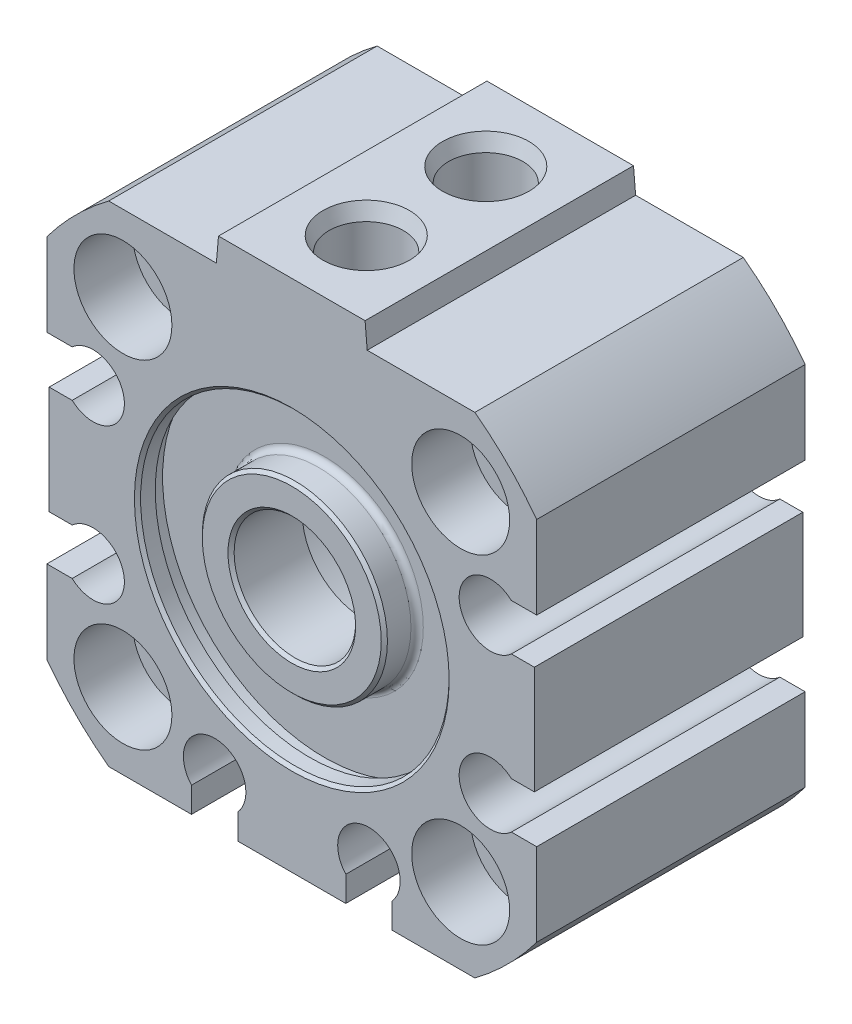
from build123d import *

# Parameters (mm, degrees)
EXTRUDE1_DEPTH                               = 8.6995
EXTRUDE1_DEPTH_BACK                          = 8.6995
SKETCH1_W                                    = 31.75
SKETCH1_H                                    = 31.75
F_056_250_NOSE_CHAMFER_R                     = 0.4
SKETCH13_R                                   = 22.450640303
SKETCH13_R_2                                 = 19.82
F_075_250_TUBE_EDGE_ROUNDOVER_DEPTH          = 29.403458434
F_075_250_PORT_BOSS_DEPTH                    = 17.399
F_075_PORT_10_32_AT_2_COUNT                  = 2
F_075_PORT_10_32_AT_2_PITCH                  = 7.747
F_075_250_SWITCH_GROOVE_DEPTH                = 30.321784581
F_075_106_SWITCH_GROOVE_CIRC_PATTERN_COUNT   = 3
F_075_106_SWITCH_GROOVE_CIRC_PATTERN_ANGLE   = 180
SKETCH19_W                                   = 0.15
SKETCH19_H                                   = 7
F_075_250_THIN_SIDE_CUTS_DEPTH               = 30.321784581
SKETCH20_R                                   = 1.95
F_075_250_MOUNT_THRU_HOLE_DEPTH              = 30.321784581
F_075_250_MOUNT_THRU_HOLE_CIRC_PATTERN_COUNT = 4
SKETCH21_R                                   = 3.175
F_075_250_B_MOUNT_CBORE_ROD_END_DEPTH        = 3.81
F_056_250_START                              = -4.0875
SKETCH22_R                                   = 9.525
F_056_250_STROKE_CHAMBER_DEPTH               = 8.175
SKETCH23_R                                   = 3.937
F_056_250_ROD_THRU_BORE_DEPTH                = 26.153988754
F_056_250_COLLAR_CHAMFER_SIZE                = 0.2


with BuildPart() as part:
    # Sketch1 → Extrude1 (new, two sides: drawn at the far end of the back side and taken through both)
    with BuildSketch(Plane.XY.offset(-EXTRUDE1_DEPTH_BACK)):
        Rectangle(SKETCH1_W, SKETCH1_H)
    extrude(amount=EXTRUDE1_DEPTH + EXTRUDE1_DEPTH_BACK)

    # Sketch33 → 056-250 Front Recess (revolve, cut)
    with BuildSketch(Plane(origin=(0, 0, 0), x_dir=(0, 0, -1), z_dir=(1, 0, 0)), mode=Mode.PRIVATE) as f_056_250_front_recess_sk:
        Polygon((-8.6995, 10), (-7.5495, 10), (-7.5495, 10.5), (-6.5745, 10.5), (-6.5745, 6), (-8.6995, 6), align=None)
    revolve(f_056_250_front_recess_sk.sketch.rotate(Axis((0, 0, 61.220394237), (0, 0, -1)), 90), axis=Axis((0, 0, 61.220394237), (0, 0, -1)), mode=Mode.SUBTRACT)

    # 056-250 Nose Chamfer
    f_056_250_nose_chamfer_edges = [part.edges().sort_by_distance(p)[0] for p in [
        (-6, 0, 6.5745),
    ]]
    fillet(f_056_250_nose_chamfer_edges, radius=F_056_250_NOSE_CHAMFER_R)

    # Sketch13 → 075-250 Tube Edge Roundover (cut, through all)
    with BuildSketch(Plane.XY.offset(8.6995)):
        Circle(SKETCH13_R)
        Circle(SKETCH13_R_2, mode=Mode.SUBTRACT)
    extrude(amount=-F_075_250_TUBE_EDGE_ROUNDOVER_DEPTH, mode=Mode.SUBTRACT)

    # Sketch14 → 075-250 Port Boss (add)
    with BuildSketch(Plane.XY.offset(8.6995)):
        Polygon((-4.75, 17.465), (4.75, 17.465), (4.889106975, 15.875), (-4.889106975, 15.875), align=None)
    extrude(amount=-F_075_250_PORT_BOSS_DEPTH)

    # Sketch35 → 075  Port #10-32 (revolve, cut)
    with BuildSketch(Plane(origin=(0, 17.465, 3.8735), x_dir=(0, 0, 1), z_dir=(1, 0, 0))):
        Polygon((0, 0), (0, 7.590757848), (2.0193, 6.37744), (2.0193, 4), (2.413, 4), (2.413, 0.934287129), (2.7999944, 0), align=None)
    f_075_port_10_32 = revolve(axis=Axis((0, 23.815, 3.8735), (0, -1, 0)), mode=Mode.SUBTRACT)

    # 075  Port #10-32 at 2: 075  Port #10-32 ×2
    with Locations(*[(0, 0, -i * F_075_PORT_10_32_AT_2_PITCH) for i in range(1, F_075_PORT_10_32_AT_2_COUNT)]):
        add(f_075_port_10_32, mode=Mode.SUBTRACT)

    # Sketch15 → 075-250 Switch Groove (cut, through all)
    with BuildSketch(Plane.XY.offset(8.6995)):
        with BuildLine():
            Line((-15.875, 6.5), (-14.235376786, 6.5))
            ThreePointArc((-14.235376786, 6.5), (-10.85, 5), (-14.235376786, 3.5))
            Line((-14.235376786, 3.5), (-15.875, 3.5))
            Line((-15.875, 3.5), (-15.875, 6.5))
        make_face()
        with BuildLine():
            Line((-15.875, -6.5), (-15.875, -3.5))
            Line((-15.875, -3.5), (-14.235376786, -3.5))
            ThreePointArc((-14.235376786, -3.5), (-10.85, -5), (-14.235376786, -6.5))
            Line((-14.235376786, -6.5), (-15.875, -6.5))
        make_face()
    f_075_250_switch_groove = extrude(amount=-F_075_250_SWITCH_GROOVE_DEPTH, mode=Mode.SUBTRACT)

    # 075-106 Switch Groove Circ Pattern: 075-250 Switch Groove ×3 about axis
    f_075_106_switch_groove_circ_pattern_axis = Axis((0, 0, 0), (0, 0, 1))
    for i in range(1, F_075_106_SWITCH_GROOVE_CIRC_PATTERN_COUNT):
        add(f_075_250_switch_groove.rotate(f_075_106_switch_groove_circ_pattern_axis, i * F_075_106_SWITCH_GROOVE_CIRC_PATTERN_ANGLE / (F_075_106_SWITCH_GROOVE_CIRC_PATTERN_COUNT - 1)), mode=Mode.SUBTRACT)

    # Sketch19 → 075-250 Thin Side Cuts (cut, through all)
    with BuildSketch(Plane.XY.offset(8.6995)):
        with Locations((15.8, 0)):
            Rectangle(SKETCH19_W, SKETCH19_H)
        with Locations((-15.8, 0)):
            Rectangle(SKETCH19_W, SKETCH19_H)
    extrude(amount=-F_075_250_THIN_SIDE_CUTS_DEPTH, mode=Mode.SUBTRACT)

    # Sketch20 → 075-250 Mount Thru Hole (cut, through all)
    with BuildSketch(Plane.XY.offset(8.6995)):
        with Locations((10.945, 10.945)):
            Circle(SKETCH20_R)
    f_075_250_mount_thru_hole = extrude(amount=-F_075_250_MOUNT_THRU_HOLE_DEPTH, mode=Mode.SUBTRACT)

    # 075-250 Mount Thru Hole Circ Pattern: 075-250 Mount Thru Hole ×4 about axis
    f_075_250_mount_thru_hole_circ_pattern_axis = Axis((0, 0, 0), (0, 0, 1))
    for i in range(1, F_075_250_MOUNT_THRU_HOLE_CIRC_PATTERN_COUNT):
        add(f_075_250_mount_thru_hole.rotate(f_075_250_mount_thru_hole_circ_pattern_axis, i * 360 / F_075_250_MOUNT_THRU_HOLE_CIRC_PATTERN_COUNT), mode=Mode.SUBTRACT)

    # Sketch21 → 075-250 B Mount CBore Rod End (cut)
    with BuildSketch(Plane.XY.offset(8.6995)):
        with Locations((-10.945, 10.945)):
            Circle(SKETCH21_R)
        with Locations((-10.945, -10.945)):
            Circle(SKETCH21_R)
        with Locations((10.945, 10.945)):
            Circle(SKETCH21_R)
        with Locations((10.945, -10.945)):
            Circle(SKETCH21_R)
    f_075_250_b_mount_cbore_rod_end = extrude(amount=-F_075_250_B_MOUNT_CBORE_ROD_END_DEPTH, mode=Mode.SUBTRACT)

    # 075-250 B Mount CBore Non-Rod End: 075-250 B Mount CBore Rod End across plane
    add(f_075_250_b_mount_cbore_rod_end.mirror(Plane.XY), mode=Mode.SUBTRACT)

    # Sketch22 → 056-250 Stroke Chamber (cut)
    with BuildSketch(Plane.XY.offset(F_056_250_START)):
        Circle(SKETCH22_R)
    extrude(amount=F_056_250_STROKE_CHAMBER_DEPTH, mode=Mode.SUBTRACT)

    # Sketch23 → 056-250 Rod Thru Bore (cut, through all)
    with BuildSketch(Plane.XY):
        with Locations(Location((0, 0, 0), (0, 0, 180))):
            Circle(SKETCH23_R)
    extrude(amount=F_056_250_ROD_THRU_BORE_DEPTH, mode=Mode.SUBTRACT)

    # 056-250 Collar Chamfer
    f_056_250_collar_chamfer_edges = [part.edges().sort_by_distance(p)[0] for p in [
        (-10, 0, 8.6995),
        (-6, 0, 8.6995),
        (3.937, 0, 8.6995),
    ]]
    chamfer(f_056_250_collar_chamfer_edges, length=F_056_250_COLLAR_CHAMFER_SIZE)


solid = part.part
